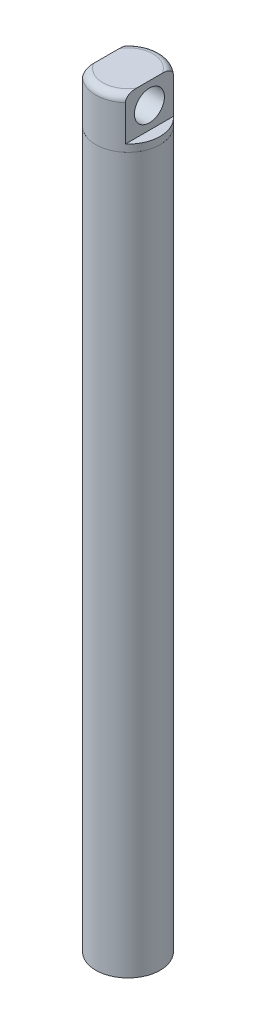
from build123d import *

# Parameters (mm, degrees)
SKETCH_1_R          = 4.5
EXTRUDE_1_DEPTH     = 100
SKETCH_2_R          = 4.5
EXTRUDE_2_DEPTH     = 7
FILLET_1_R          = 1
SKETCH_3_W          = 2.376360743
SKETCH_3_H          = 9.201019787
CUT_EXTRUDE_3_DEPTH = 13.5
SKETCH_4_R          = 2.1
CUT_EXTRUDE_4_DEPTH = 108.356881579


with BuildPart() as part:
    # Эскиз1 → Вытянуть1 (new body)
    with BuildSketch(Plane(origin=(0, 0, 0), x_dir=(1, 0, 0), z_dir=(0, 1, 0))):
        with Locations(Location((0, 0, 0), (0, 0, 270))):
            Circle(SKETCH_1_R)
    extrude(amount=EXTRUDE_1_DEPTH)


with BuildPart() as body_2:
    # Эскиз2 → Вытянуть2 (new body)
    with BuildSketch(Plane(origin=(0, 100, 0), x_dir=(1, 0, 0), z_dir=(0, 1, 0))):
        with Locations(Location((0, 0, 0), (0, 0, 270))):
            Circle(SKETCH_2_R)
    extrude(amount=EXTRUDE_2_DEPTH)

    # Скругление1
    fillet_1_edges = [body_2.edges().sort_by_distance(p)[0] for p in [
        (0, 107, -4.5),
    ]]
    fillet(fillet_1_edges, radius=FILLET_1_R)

    # Эскиз3 → Вытянуть3 (cut, symmetric)
    with BuildSketch(Plane.XY):
        with Locations((-4.188180371, 105.600509894)):
            Rectangle(SKETCH_3_W, SKETCH_3_H)
        with Locations((4.188180371, 105.600509894)):
            Rectangle(SKETCH_3_W, SKETCH_3_H)
    extrude(amount=CUT_EXTRUDE_3_DEPTH, both=True, mode=Mode.SUBTRACT)

    # Эскиз4 → Вытянуть4 (cut, through all)
    with BuildSketch(Plane(origin=(3, 0, 0), x_dir=(0, 0, -1), z_dir=(1, 0, 0))):
        with Locations(Location((0, 104, 0), (0, 0, 90))):
            Circle(SKETCH_4_R)
    extrude(amount=-CUT_EXTRUDE_4_DEPTH, mode=Mode.SUBTRACT)


solid = Compound([part.part, body_2.part])
